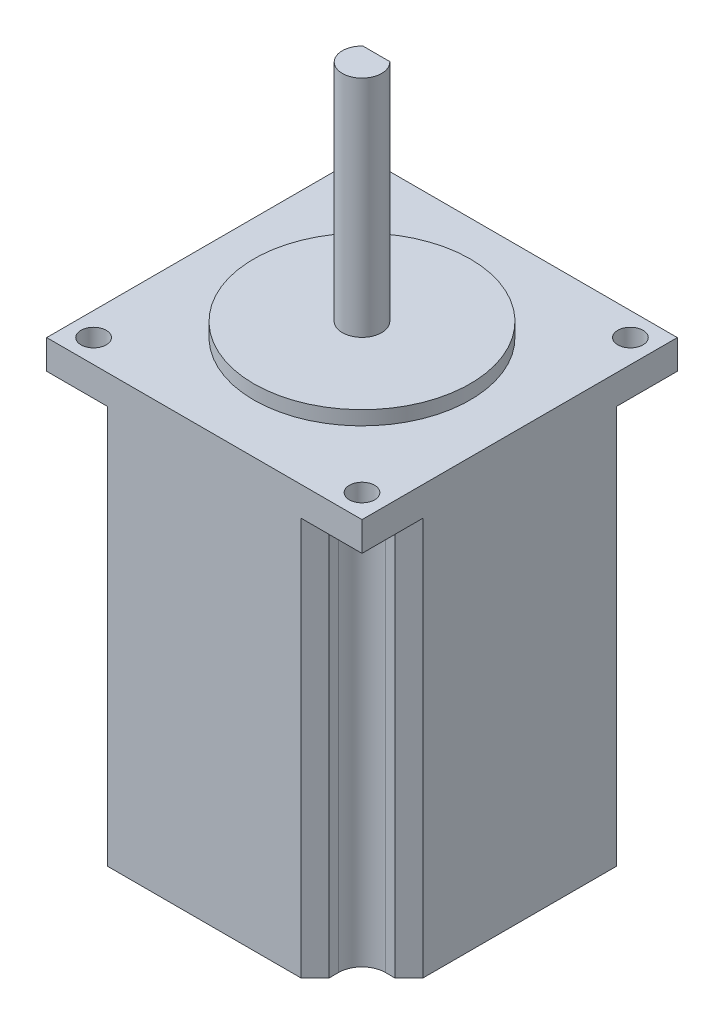
from build123d import *

# Parameters (mm, degrees)
CROQUIS1_W                                 = 56.1
CROQUIS1_H                                 = 56.1
SALIENTE_EXTRUIR1_DEPTH                    = 76.05
CORTAR_EXTRUIR1_DEPTH                      = 82.199307
SIMETR_A3_AT_THE_SECOND_PLANE_COPY_1_DEPTH = 82.199307
CHAFL_N1_SIZE                              = 2.5
CROQUIS3_R                                 = 2.25
CORTAR_EXTRUIR2_DEPTH                      = 82.199307
SIMETR_A4_AT_THE_SECOND_PLANE_COPY_1_SKE_R = 2.25
SIMETR_A4_AT_THE_SECOND_PLANE_COPY_1_DEPTH = 82.199307
CROQUIS4_R                                 = 19.25
SALIENTE_EXTRUIR2_DEPTH                    = 2.5
CROQUIS6_R                                 = 3.5
SALIENTE_EXTRUIR4_DEPTH                    = 11.7
SALIENTE_EXTRUIR5_DEPTH                    = 28.15
SALIENTE_EXTRUIR3_DEPTH                    = 39.95


with BuildPart() as part:
    # Croquis1 → Saliente-Extruir1 (new body)
    with BuildSketch(Plane(origin=(0, 0, 0), x_dir=(1, 0, 0), z_dir=(0, 1, 0))):
        Rectangle(CROQUIS1_W, CROQUIS1_H)
    extrude(amount=SALIENTE_EXTRUIR1_DEPTH)

    # Croquis2 → Cortar-Extruir1 (cut, through all)
    with BuildSketch(Plane(origin=(0, 70.85, 0), x_dir=(1, 0, 0), z_dir=(0, 1, 0))):
        with BuildLine():
            Line((-28.05, 19.7), (-23.875, 19.7))
            ThreePointArc((-23.875, 19.7), (-20.922829, 20.922829), (-19.7, 23.875))
            Line((-19.7, 23.875), (-19.7, 28.05))
            Line((-19.7, 28.05), (-28.05, 28.05))
            Line((-28.05, 28.05), (-28.05, 19.7))
        make_face()
    cortar_extruir1 = extrude(amount=-CORTAR_EXTRUIR1_DEPTH, mode=Mode.SUBTRACT)

    # Simetría3: Cortar-Extruir1 across plane
    add(cortar_extruir1.mirror(Plane(origin=(0, 0, 0), x_dir=(0, 0, 1), z_dir=(1, 0, 0))), mode=Mode.SUBTRACT)

    # Simetría3 at the second plane: Cortar-Extruir1 across plane
    add(cortar_extruir1.mirror(Plane.XY), mode=Mode.SUBTRACT)

    # Simetría3 at the second plane copy 1 ske → Simetría3 at the second plane copy 1 (cut, through all)
    with BuildSketch(Plane(origin=(0, 70.85, 0), x_dir=(-1, 0, 0), z_dir=(0, 1, 0))):
        with BuildLine():
            Line((-28.05, 19.7), (-23.875, 19.7))
            ThreePointArc((-23.875, 19.7), (-20.922829, 20.922829), (-19.7, 23.875))
            Line((-19.7, 23.875), (-19.7, 28.05))
            Line((-19.7, 28.05), (-28.05, 28.05))
            Line((-28.05, 28.05), (-28.05, 19.7))
        make_face()
    extrude(amount=-SIMETR_A3_AT_THE_SECOND_PLANE_COPY_1_DEPTH, mode=Mode.SUBTRACT)

    # Chaflán1
    chafl_n1_edges = [part.edges().sort_by_distance(p)[0] for p in [
        (-28.05, 35.425, -19.7),
        (-19.7, 35.425, -28.05),
        (-28.05, 35.425, 19.7),
        (-19.7, 35.425, 28.05),
        (28.05, 35.425, -19.7),
        (19.7, 35.425, -28.05),
        (28.05, 35.425, 19.7),
        (19.7, 35.425, 28.05),
    ]]
    chamfer(chafl_n1_edges, length=CHAFL_N1_SIZE)

    # Croquis3 → Cortar-Extruir2 (cut, through all)
    with BuildSketch(Plane.XZ.offset(-70.85)):
        with Locations(Location((23.875, -23.875, 0), (0, 0, 270))):
            Circle(CROQUIS3_R)
    cortar_extruir2 = extrude(amount=-CORTAR_EXTRUIR2_DEPTH, mode=Mode.SUBTRACT)

    # Simetría4: Cortar-Extruir2 across plane
    add(cortar_extruir2.mirror(Plane(origin=(0, 0, 0), x_dir=(0, 0, 1), z_dir=(1, 0, 0))), mode=Mode.SUBTRACT)

    # Simetría4 at the second plane: Cortar-Extruir2 across plane
    add(cortar_extruir2.mirror(Plane.XY), mode=Mode.SUBTRACT)

    # Simetría4 at the second plane copy 1 ske → Simetría4 at the second plane copy 1 (cut, through all)
    with BuildSketch(Plane(origin=(0, 70.85, 0), x_dir=(-1, 0, 0), z_dir=(0, -1, 0))):
        with Locations(Location((23.875, -23.875, 0), (0, 0, 270))):
            Circle(SIMETR_A4_AT_THE_SECOND_PLANE_COPY_1_SKE_R)
    extrude(amount=-SIMETR_A4_AT_THE_SECOND_PLANE_COPY_1_DEPTH, mode=Mode.SUBTRACT)

    # Croquis4 → Saliente-Extruir2 (add)
    with BuildSketch(Plane(origin=(0, 76.05, 0), x_dir=(1, 0, 0), z_dir=(0, 1, 0))):
        with Locations(Location((0, 0, 0), (0, 0, 270))):
            Circle(CROQUIS4_R)
    extrude(amount=SALIENTE_EXTRUIR2_DEPTH)

    # Croquis6 → Saliente-Extruir4 (add)
    with BuildSketch(Plane(origin=(0, 78.55, 0), x_dir=(1, 0, 0), z_dir=(0, 1, 0))):
        with Locations(Location((0, 0, 0), (0, 0, 270))):
            Circle(CROQUIS6_R)
    extrude(amount=SALIENTE_EXTRUIR4_DEPTH)

    # Croquis7 → Saliente-Extruir5 (add)
    with BuildSketch(Plane(origin=(0, 90.25, 0), x_dir=(1, 0, 0), z_dir=(0, 1, 0))):
        with BuildLine():
            Line((-2.397394, 2.55), (2.397394, 2.55))
            ThreePointArc((2.397394, 2.55), (0, -3.5), (-2.397394, 2.55))
        make_face()
    extrude(amount=SALIENTE_EXTRUIR5_DEPTH)

    # Croquis5 → Saliente-Extruir3 (add)
    with BuildSketch(Plane(origin=(0, 78.55, 0), x_dir=(1, 0, 0), z_dir=(0, 1, 0))):
        with BuildLine():
            Line((-2.397394, 2.55), (2.397394, 2.55))
            ThreePointArc((2.397394, 2.55), (0, -3.5), (-2.397394, 2.55))
        make_face()
    extrude(amount=SALIENTE_EXTRUIR3_DEPTH)


solid = part.part
